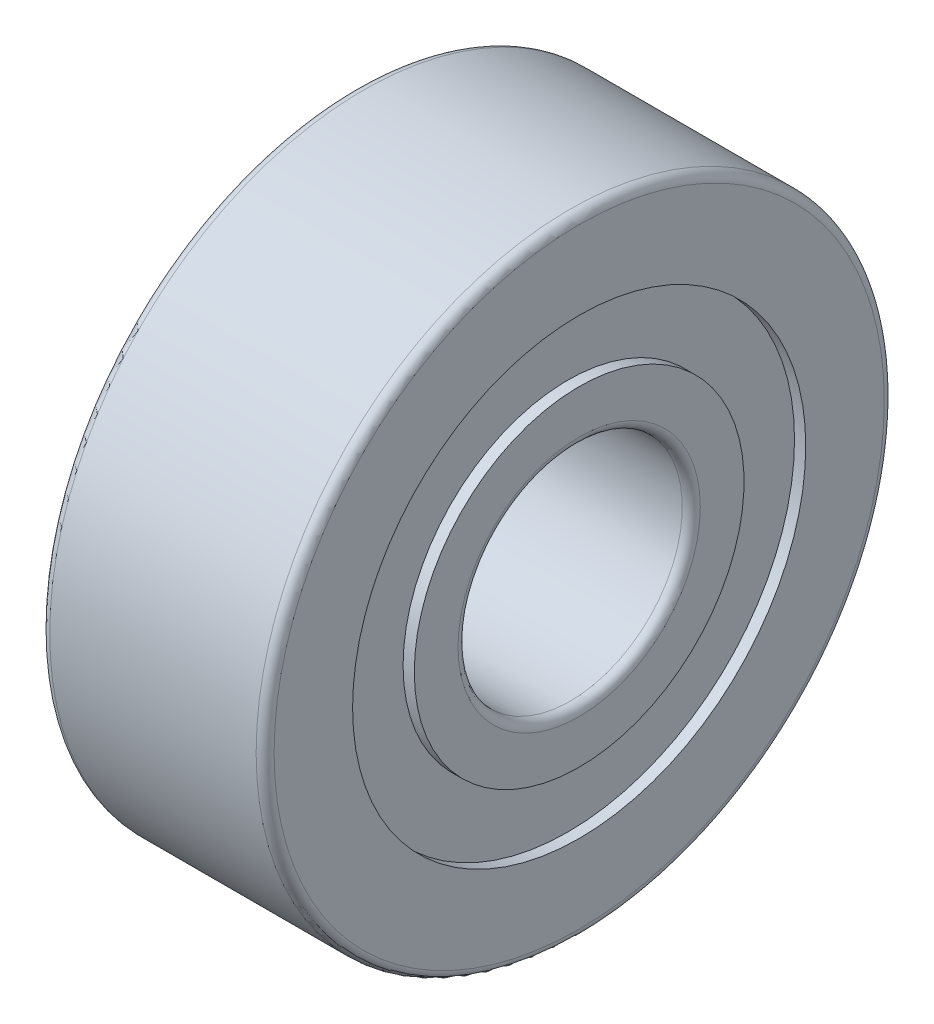
from build123d import *

# Parameters (mm, degrees)
FILLET_1_R = 0.2


with BuildPart() as part:
    # 草图1 → 旋转1 (revolve)
    with BuildSketch(Plane.XY, mode=Mode.PRIVATE) as revolve_1_sk:
        Polygon((-2.5, 7), (2.5, 7), (2.5, 5.05), (2.25, 5.05), (2.25, 3.675), (2.5, 3.675), (2.5, 2.5), (-2.5, 2.5), (-2.5, 3.675), (-2.25, 3.675), (-2.25, 5.05), (-2.5, 5.05), align=None)
    revolve(revolve_1_sk.sketch.rotate(Axis((0, 0, 0), (1, 0, 0)), 90), axis=Axis((0, 0, 0), (1, 0, 0)))

    # 圆角1
    fillet_1_edges = [part.edges().sort_by_distance(p)[0] for p in [
        (2.5, 0, -2.5),
        (-2.5, 0, -2.5),
        (-2.5, 0, -7),
        (2.5, 0, -7),
    ]]
    fillet(fillet_1_edges, radius=FILLET_1_R)


solid = part.part
